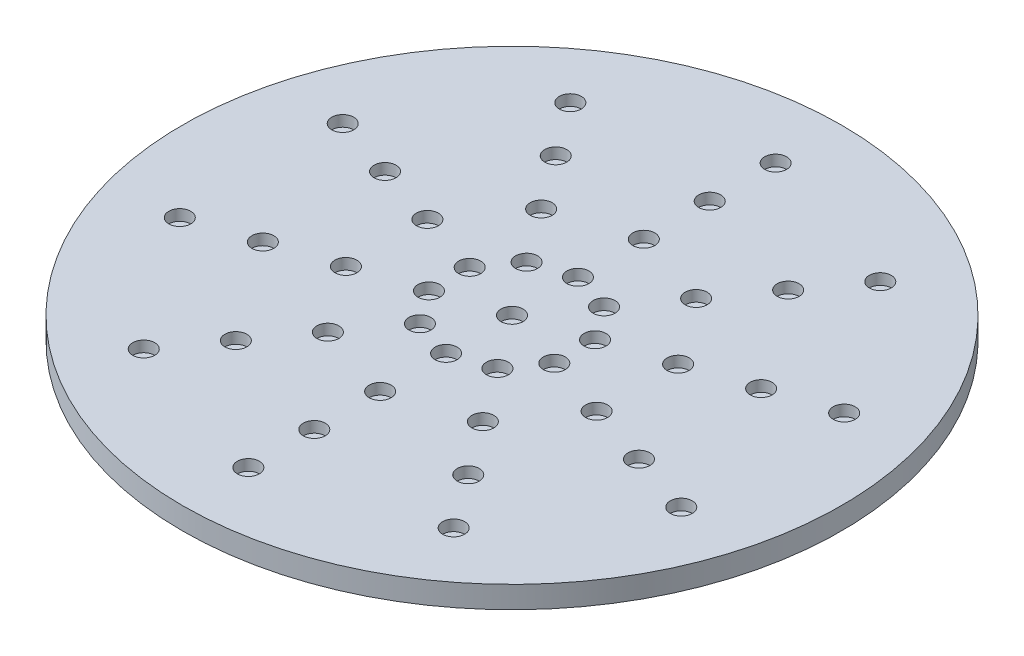
from build123d import *

# Parameters (mm, degrees)
SKETCH1_R           = 381
BOSS_EXTRUDE1_DEPTH = 12.7
SKETCH2_R           = 12.7
CUT_EXTRUDE1_DEPTH  = 12.7


with BuildPart() as part:
    # Sketch1 → Boss-Extrude1 (new, symmetric)
    with BuildSketch(Plane(origin=(0, 0, 0), x_dir=(1, 0, 0), z_dir=(0, 1, 0))):
        with Locations(Location((0, 0, 0), (0, 0, 270))):
            Circle(SKETCH1_R)
    extrude(amount=BOSS_EXTRUDE1_DEPTH, both=True)

    # Sketch2 → Cut-Extrude1 (cut)
    with BuildSketch(Plane(origin=(0, 12.7, 0), x_dir=(1, 0, 0), z_dir=(0, 1, 0))):
        with Locations(Location((0, 304.8, 0), (0, 0, 270))):
            Circle(SKETCH2_R)
        with Locations(Location((-179.156944899, 246.588379885, 0), (0, 0, 270))):
            Circle(SKETCH2_R)
        with Locations(Location((-289.882026167, 94.188379885, 0), (0, 0, 270))):
            Circle(SKETCH2_R)
        with Locations(Location((-289.882026167, -94.188379886, 0), (0, 0, 270))):
            Circle(SKETCH2_R)
        with Locations(Location((-179.156944899, -246.588379886, 0), (0, 0, 270))):
            Circle(SKETCH2_R)
        with Locations(Location((0, -304.8, 0), (0, 0, 270))):
            Circle(SKETCH2_R)
        with Locations(Location((179.156944899, -246.588379885, 0), (0, 0, 270))):
            Circle(SKETCH2_R)
        with Locations(Location((289.882026167, -94.188379885, 0), (0, 0, 270))):
            Circle(SKETCH2_R)
        with Locations(Location((289.882026167, 94.188379886, 0), (0, 0, 270))):
            Circle(SKETCH2_R)
        with Locations(Location((179.156944899, 246.588379886, 0), (0, 0, 270))):
            Circle(SKETCH2_R)
        with Locations(Location((0, 228.6, 0), (0, 0, 270))):
            Circle(SKETCH2_R)
        with Locations(Location((0, 152.4, 0), (0, 0, 270))):
            Circle(SKETCH2_R)
        with Locations(Location((0, 76.2, 0), (0, 0, 270))):
            Circle(SKETCH2_R)
        with Locations(Location((0, 0, 0), (0, 0, 270))):
            Circle(SKETCH2_R)
        with Locations(Location((-134.367708674, 184.941284914, 0), (0, 0, 270))):
            Circle(SKETCH2_R)
        with Locations(Location((-89.578472449, 123.294189943, 0), (0, 0, 270))):
            Circle(SKETCH2_R)
        with Locations(Location((-44.789236225, 61.647094971, 0), (0, 0, 270))):
            Circle(SKETCH2_R)
        with Locations(Location((-217.411519625, 70.641284914, 0), (0, 0, 270))):
            Circle(SKETCH2_R)
        with Locations(Location((-144.941013083, 47.094189943, 0), (0, 0, 270))):
            Circle(SKETCH2_R)
        with Locations(Location((-72.470506542, 23.547094971, 0), (0, 0, 270))):
            Circle(SKETCH2_R)
        with Locations(Location((-217.411519625, -70.641284914, 0), (0, 0, 270))):
            Circle(SKETCH2_R)
        with Locations(Location((-144.941013083, -47.094189943, 0), (0, 0, 270))):
            Circle(SKETCH2_R)
        with Locations(Location((-72.470506542, -23.547094971, 0), (0, 0, 270))):
            Circle(SKETCH2_R)
        with Locations(Location((-134.367708674, -184.941284914, 0), (0, 0, 270))):
            Circle(SKETCH2_R)
        with Locations(Location((-89.578472449, -123.294189943, 0), (0, 0, 270))):
            Circle(SKETCH2_R)
        with Locations(Location((-44.789236225, -61.647094971, 0), (0, 0, 270))):
            Circle(SKETCH2_R)
        with Locations(Location((0, -228.6, 0), (0, 0, 270))):
            Circle(SKETCH2_R)
        with Locations(Location((0, -152.4, 0), (0, 0, 270))):
            Circle(SKETCH2_R)
        with Locations(Location((0, -76.2, 0), (0, 0, 270))):
            Circle(SKETCH2_R)
        with Locations(Location((134.367708674, -184.941284914, 0), (0, 0, 270))):
            Circle(SKETCH2_R)
        with Locations(Location((89.578472449, -123.294189943, 0), (0, 0, 270))):
            Circle(SKETCH2_R)
        with Locations(Location((44.789236225, -61.647094971, 0), (0, 0, 270))):
            Circle(SKETCH2_R)
        with Locations(Location((217.411519625, -70.641284914, 0), (0, 0, 270))):
            Circle(SKETCH2_R)
        with Locations(Location((144.941013083, -47.094189943, 0), (0, 0, 270))):
            Circle(SKETCH2_R)
        with Locations(Location((72.470506542, -23.547094971, 0), (0, 0, 270))):
            Circle(SKETCH2_R)
        with Locations(Location((217.411519625, 70.641284914, 0), (0, 0, 270))):
            Circle(SKETCH2_R)
        with Locations(Location((144.941013083, 47.094189943, 0), (0, 0, 270))):
            Circle(SKETCH2_R)
        with Locations(Location((72.470506542, 23.547094971, 0), (0, 0, 270))):
            Circle(SKETCH2_R)
        with Locations(Location((134.367708674, 184.941284914, 0), (0, 0, 270))):
            Circle(SKETCH2_R)
        with Locations(Location((89.578472449, 123.294189943, 0), (0, 0, 270))):
            Circle(SKETCH2_R)
        with Locations(Location((44.789236225, 61.647094971, 0), (0, 0, 270))):
            Circle(SKETCH2_R)
    extrude(amount=-CUT_EXTRUDE1_DEPTH, mode=Mode.SUBTRACT)


solid = part.part
